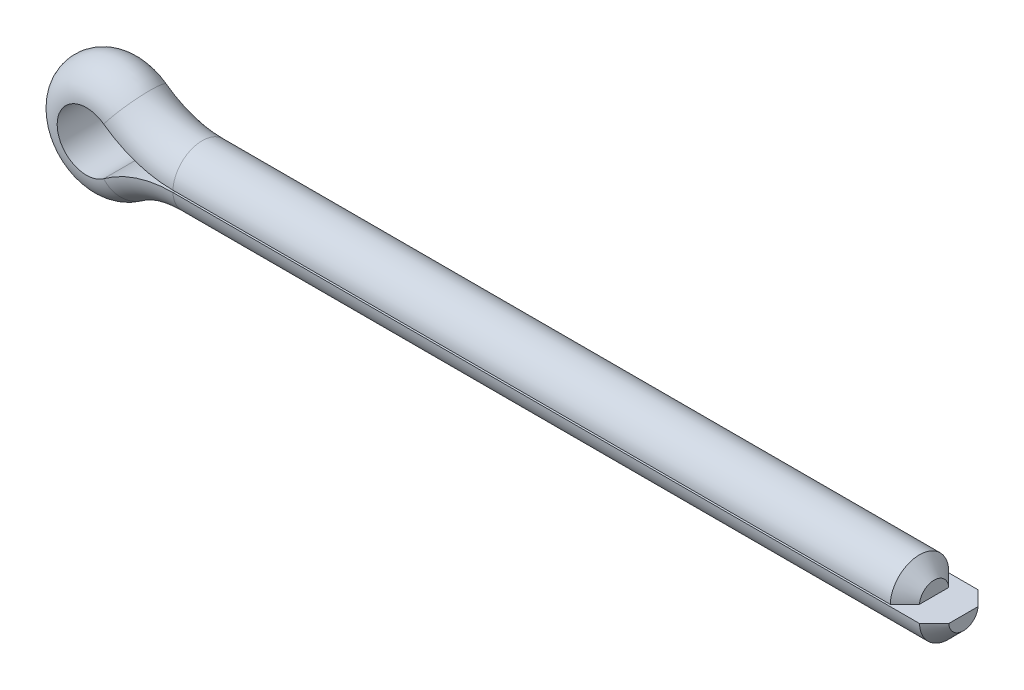
from build123d import *

# Parameters (mm, degrees)
CHAMFER1_SIZE = 0.381


with BuildPart() as part:
    # Sweep1: sweep along a path in Sketch3
    with BuildLine(Plane.XY) as sweep1_path:
        Line((0.762, -0.0254), (-19.05, -0.0254))
        ThreePointArc((-19.05, -0.0254), (-19.997661712, -0.176463466), (-20.851388343, -0.61468))
        ThreePointArc((-20.851388343, -0.61468), (-22.063735429, 0), (-20.851388343, 0.61468))
        ThreePointArc((-20.851388343, 0.61468), (-19.997661712, 0.176463466), (-19.05, 0.0254))
        Line((-19.05, 0.0254), (0, 0.0254))
    # Sketch4 → Sweep1 (sweep)
    with BuildSketch(Plane(origin=(0, 0, 0), x_dir=(0, 0, -1), z_dir=(1, 0, 0))):
        with BuildLine():
            Line((-0.761576549, 0.0254), (0.761576549, 0.0254))
            ThreePointArc((0.761576549, 0.0254), (0, 0.762), (-0.761576549, 0.0254))
        make_face()
    sweep(path=sweep1_path.line)

    # Chamfer1
    chamfer1_edges = [part.edges().sort_by_distance(p)[0] for p in [
        (0, 0.762, 0),
        (0.762, -0.762, 0),
    ]]
    chamfer(chamfer1_edges, length=CHAMFER1_SIZE)


solid = part.part
